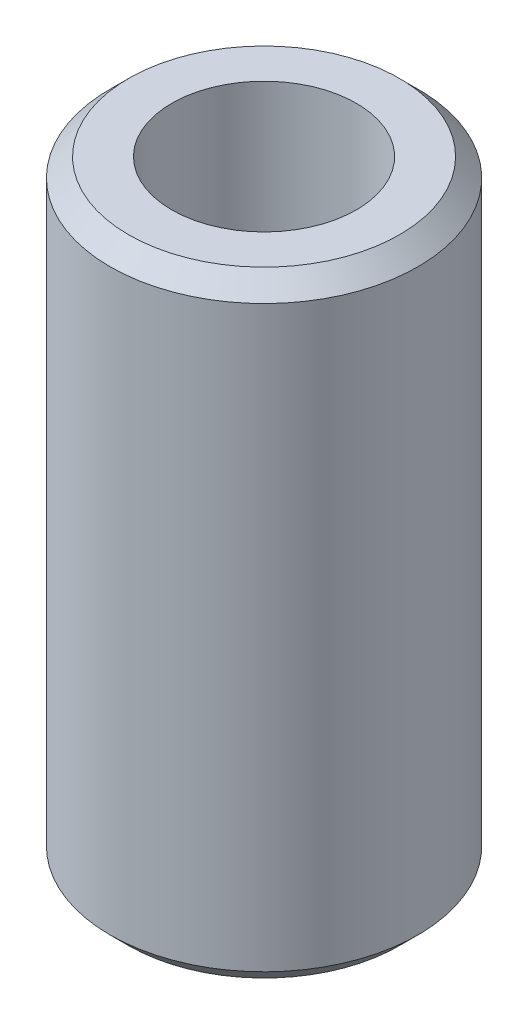
from build123d import *

# Parameters (mm, degrees)
SKETCH_1_R      = 2.5
SKETCH_1_R_2    = 1.5
EXTRUDE_1_DEPTH = 10
CHAMFER_1_SIZE  = 0.3


with BuildPart() as part:
    # 草图1 → 凸台-拉伸1 (new body)
    with BuildSketch(Plane(origin=(0, 0, 0), x_dir=(1, 0, 0), z_dir=(0, 1, 0))):
        with Locations(Location((0, 0, 0), (0, 0, 270))):
            Circle(SKETCH_1_R)
        with Locations(Location((0, 0, 0), (0, 0, 270))):
            Circle(SKETCH_1_R_2, mode=Mode.SUBTRACT)
    extrude(amount=EXTRUDE_1_DEPTH)

    # 倒角1
    chamfer_1_edges = [part.edges().sort_by_distance(p)[0] for p in [
        (0, 0, -2.5),
        (0, 10, -2.5),
    ]]
    chamfer(chamfer_1_edges, length=CHAMFER_1_SIZE)


solid = part.part
